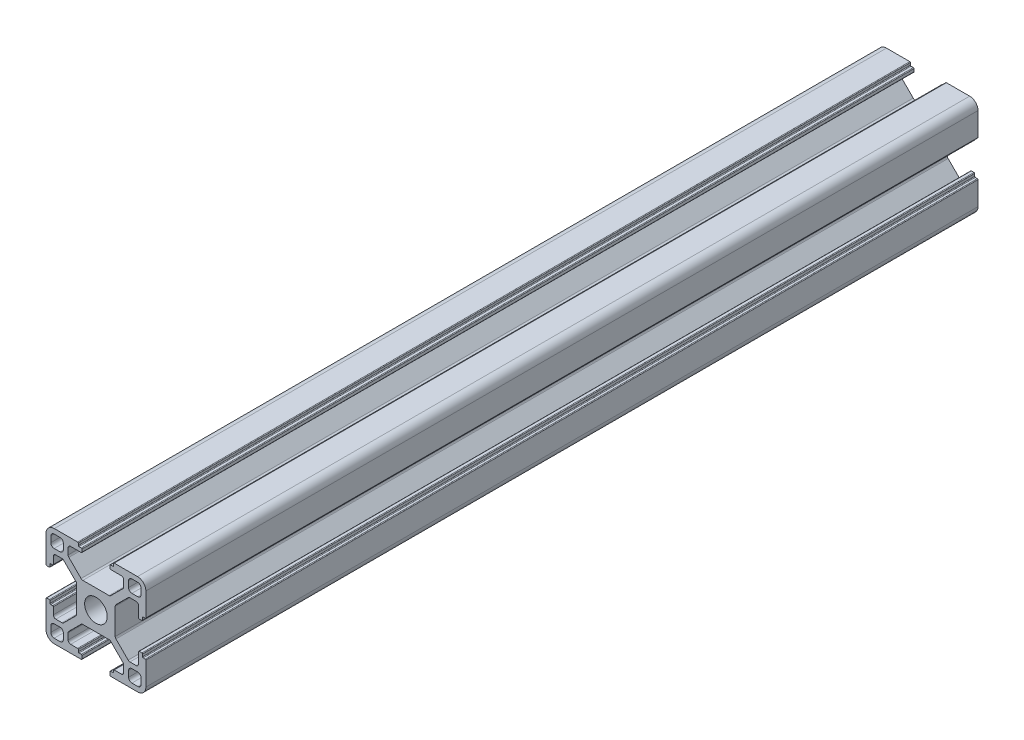
from build123d import *

# Parameters (mm, degrees)
SKETCH1_R           = 3.4
BOSS_EXTRUDE1_DEPTH = 250


with BuildPart() as part:
    # Sketch1 → Boss-Extrude1 (new body)
    with BuildSketch(Plane.XY):
        with BuildLine():
            Line((0, 2.5), (0, 10.6))
            ThreePointArc((0, 10.6), (0.058578644, 10.741421356), (0.2, 10.8))
            Line((0.2, 10.8), (1, 10.8))
            ThreePointArc((1, 10.8), (1.141421356, 10.741421356), (1.2, 10.6))
            Line((1.2, 10.6), (1.2, 9.9))
            ThreePointArc((1.2, 9.9), (1.258578644, 9.758578644), (1.4, 9.7))
            Line((1.4, 9.7), (2, 9.7))
            ThreePointArc((2, 9.7), (2.141421356, 9.641421356), (2.2, 9.5))
            Line((2.2, 9.5), (2.2, 7.4))
            ThreePointArc((2.2, 7.4), (2.419669914, 6.869669914), (2.95, 6.65))
            Line((2.95, 6.65), (4.78370491, 6.65))
            ThreePointArc((4.78370491, 6.65), (5.070717484, 6.707090351), (5.314034995, 6.869669914))
            Line((5.314034995, 6.869669914), (8.980330086, 10.535965005))
            ThreePointArc((8.980330086, 10.535965005), (9.142909649, 10.779282516), (9.2, 11.06629509))
            Line((9.2, 11.06629509), (9.2, 18.93370491))
            ThreePointArc((9.2, 18.93370491), (9.142909649, 19.220717484), (8.980330086, 19.464034995))
            Line((8.980330086, 19.464034995), (5.314034995, 23.130330086))
            ThreePointArc((5.314034995, 23.130330086), (5.070717484, 23.292909649), (4.78370491, 23.35))
            Line((4.78370491, 23.35), (2.95, 23.35))
            ThreePointArc((2.95, 23.35), (2.419669914, 23.130330086), (2.2, 22.6))
            Line((2.2, 22.6), (2.2, 20.5))
            ThreePointArc((2.2, 20.5), (2.141421356, 20.358578644), (2, 20.3))
            Line((2, 20.3), (1.4, 20.3))
            ThreePointArc((1.4, 20.3), (1.258578644, 20.241421356), (1.2, 20.1))
            Line((1.2, 20.1), (1.2, 19.4))
            ThreePointArc((1.2, 19.4), (1.141421356, 19.258578644), (1, 19.2))
            Line((1, 19.2), (0.2, 19.2))
            ThreePointArc((0.2, 19.2), (0.058578644, 19.258578644), (0, 19.4))
            Line((0, 19.4), (0, 27.5))
            ThreePointArc((0, 27.5), (0.732233047, 29.267766953), (2.5, 30))
            Line((2.5, 30), (9.5, 30))
            ThreePointArc((9.5, 30), (9.641421356, 29.941421356), (9.7, 29.8))
            Line((9.7, 29.8), (9.7, 29.2))
            ThreePointArc((9.7, 29.2), (9.758578644, 29.058578644), (9.9, 29))
            Line((9.9, 29), (10.6, 29))
            ThreePointArc((10.6, 29), (10.741421356, 28.941421356), (10.8, 28.8))
            Line((10.8, 28.8), (10.8, 28))
            ThreePointArc((10.8, 28), (10.741421356, 27.858578644), (10.6, 27.8))
            Line((10.6, 27.8), (7.4, 27.8))
            ThreePointArc((7.4, 27.8), (6.869669914, 27.580330086), (6.65, 27.05))
            Line((6.65, 27.05), (6.65, 25.21629509))
            ThreePointArc((6.65, 25.21629509), (6.707090351, 24.929282516), (6.869669914, 24.685965005))
            Line((6.869669914, 24.685965005), (10.535965005, 21.019669914))
            ThreePointArc((10.535965005, 21.019669914), (10.779282516, 20.857090351), (11.06629509, 20.8))
            Line((11.06629509, 20.8), (18.93370491, 20.8))
            ThreePointArc((18.93370491, 20.8), (19.220717484, 20.857090351), (19.464034995, 21.019669914))
            Line((19.464034995, 21.019669914), (23.130330086, 24.685965005))
            ThreePointArc((23.130330086, 24.685965005), (23.292909649, 24.929282516), (23.35, 25.21629509))
            Line((23.35, 25.21629509), (23.35, 27.05))
            ThreePointArc((23.35, 27.05), (23.130330086, 27.580330086), (22.6, 27.8))
            Line((22.6, 27.8), (19.4, 27.8))
            ThreePointArc((19.4, 27.8), (19.258578644, 27.858578644), (19.2, 28))
            Line((19.2, 28), (19.2, 28.8))
            ThreePointArc((19.2, 28.8), (19.258578644, 28.941421356), (19.4, 29))
            Line((19.4, 29), (20.1, 29))
            ThreePointArc((20.1, 29), (20.241421356, 29.058578644), (20.3, 29.2))
            Line((20.3, 29.2), (20.3, 29.8))
            ThreePointArc((20.3, 29.8), (20.358578644, 29.941421356), (20.5, 30))
            Line((20.5, 30), (27.5, 30))
            ThreePointArc((27.5, 30), (29.267766953, 29.267766953), (30, 27.5))
            Line((30, 27.5), (30, 20.5))
            ThreePointArc((30, 20.5), (29.941421356, 20.358578644), (29.8, 20.3))
            Line((29.8, 20.3), (29.2, 20.3))
            ThreePointArc((29.2, 20.3), (29.058578644, 20.241421356), (29, 20.1))
            Line((29, 20.1), (29, 19.4))
            ThreePointArc((29, 19.4), (28.941421356, 19.258578644), (28.8, 19.2))
            Line((28.8, 19.2), (28, 19.2))
            ThreePointArc((28, 19.2), (27.858578644, 19.258578644), (27.8, 19.4))
            Line((27.8, 19.4), (27.8, 22.6))
            ThreePointArc((27.8, 22.6), (27.580330086, 23.130330086), (27.05, 23.35))
            Line((27.05, 23.35), (25.21629509, 23.35))
            ThreePointArc((25.21629509, 23.35), (24.929282516, 23.292909649), (24.685965005, 23.130330086))
            Line((24.685965005, 23.130330086), (21.019669914, 19.464034995))
            ThreePointArc((21.019669914, 19.464034995), (20.857090351, 19.220717484), (20.8, 18.93370491))
            Line((20.8, 18.93370491), (20.8, 11.06629509))
            ThreePointArc((20.8, 11.06629509), (20.857090351, 10.779282516), (21.019669914, 10.535965005))
            Line((21.019669914, 10.535965005), (24.685965005, 6.869669914))
            ThreePointArc((24.685965005, 6.869669914), (24.929282516, 6.707090351), (25.21629509, 6.65))
            Line((25.21629509, 6.65), (27.05, 6.65))
            ThreePointArc((27.05, 6.65), (27.580330086, 6.869669914), (27.8, 7.4))
            Line((27.8, 7.4), (27.8, 10.6))
            ThreePointArc((27.8, 10.6), (27.858578644, 10.741421356), (28, 10.8))
            Line((28, 10.8), (28.8, 10.8))
            ThreePointArc((28.8, 10.8), (28.941421356, 10.741421356), (29, 10.6))
            Line((29, 10.6), (29, 9.9))
            ThreePointArc((29, 9.9), (29.058578644, 9.758578644), (29.2, 9.7))
            Line((29.2, 9.7), (29.8, 9.7))
            ThreePointArc((29.8, 9.7), (29.941421356, 9.641421356), (30, 9.5))
            Line((30, 9.5), (30, 2.5))
            ThreePointArc((30, 2.5), (29.267766953, 0.732233047), (27.5, 0))
            Line((27.5, 0), (19.4, 0))
            ThreePointArc((19.4, 0), (19.258578644, 0.058578644), (19.2, 0.2))
            Line((19.2, 0.2), (19.2, 1.132430858))
            ThreePointArc((19.2, 1.132430858), (19.258578644, 1.273852214), (19.4, 1.332430858))
            Line((19.4, 1.332430858), (20.1, 1.332430858))
            ThreePointArc((20.1, 1.332430858), (20.241421356, 1.391009502), (20.3, 1.532430858))
            Line((20.3, 1.532430858), (20.3, 2))
            ThreePointArc((20.3, 2), (20.358578644, 2.141421356), (20.5, 2.2))
            Line((20.5, 2.2), (22.6, 2.2))
            ThreePointArc((22.6, 2.2), (23.130330086, 2.419669914), (23.35, 2.95))
            Line((23.35, 2.95), (23.35, 4.916135768))
            ThreePointArc((23.35, 4.916135768), (23.292909649, 5.203148342), (23.130330086, 5.446465854))
            Line((23.130330086, 5.446465854), (19.464034995, 9.112760944))
            ThreePointArc((19.464034995, 9.112760944), (19.220717484, 9.275340508), (18.93370491, 9.332430858))
            Line((18.93370491, 9.332430858), (11.06629509, 9.332430858))
            ThreePointArc((11.06629509, 9.332430858), (10.779282516, 9.275340508), (10.535965005, 9.112760944))
            Line((10.535965005, 9.112760944), (6.869669914, 5.446465854))
            ThreePointArc((6.869669914, 5.446465854), (6.707090351, 5.203148342), (6.65, 4.916135768))
            Line((6.65, 4.916135768), (6.65, 3.082430858))
            ThreePointArc((6.65, 3.082430858), (6.869669914, 2.552100772), (7.4, 2.332430858))
            Line((7.4, 2.332430858), (9.5, 2.332430858))
            ThreePointArc((9.5, 2.332430858), (9.641421356, 2.273852214), (9.7, 2.132430858))
            Line((9.7, 2.132430858), (9.7, 1.532430858))
            ThreePointArc((9.7, 1.532430858), (9.758578644, 1.391009502), (9.9, 1.332430858))
            Line((9.9, 1.332430858), (10.6, 1.332430858))
            ThreePointArc((10.6, 1.332430858), (10.741421356, 1.273852214), (10.8, 1.132430858))
            Line((10.8, 1.132430858), (10.8, 0.2))
            ThreePointArc((10.8, 0.2), (10.741421356, 0.058578644), (10.6, 0))
            Line((10.6, 0), (2.5, 0))
            ThreePointArc((2.5, 0), (0.732233047, 0.732233047), (0, 2.5))
        make_face()
        with Locations((15, 15)):
            Circle(SKETCH1_R, mode=Mode.SUBTRACT)
        with BuildLine():
            Line((27.55, 1.45), (25.8, 1.45))
            ThreePointArc((25.8, 1.45), (25.092893219, 1.742893219), (24.8, 2.45))
            Line((24.8, 2.45), (24.8, 4.2))
            ThreePointArc((24.8, 4.2), (25.092893219, 4.907106781), (25.8, 5.2))
            Line((25.8, 5.2), (27.55, 5.2))
            ThreePointArc((27.55, 5.2), (28.257106781, 4.907106781), (28.55, 4.2))
            Line((28.55, 4.2), (28.55, 2.45))
            ThreePointArc((28.55, 2.45), (28.257106781, 1.742893219), (27.55, 1.45))
        make_face(mode=Mode.SUBTRACT)
        with BuildLine():
            Line((24.8, 25.8), (24.8, 27.55))
            ThreePointArc((24.8, 27.55), (25.092893219, 28.257106781), (25.8, 28.55))
            Line((25.8, 28.55), (27.55, 28.55))
            ThreePointArc((27.55, 28.55), (28.257106781, 28.257106781), (28.55, 27.55))
            Line((28.55, 27.55), (28.55, 25.8))
            ThreePointArc((28.55, 25.8), (28.257106781, 25.092893219), (27.55, 24.8))
            Line((27.55, 24.8), (25.8, 24.8))
            ThreePointArc((25.8, 24.8), (25.092893219, 25.092893219), (24.8, 25.8))
        make_face(mode=Mode.SUBTRACT)
        with BuildLine():
            Line((2.45, 28.55), (4.2, 28.55))
            ThreePointArc((4.2, 28.55), (4.907106781, 28.257106781), (5.2, 27.55))
            Line((5.2, 27.55), (5.2, 25.8))
            ThreePointArc((5.2, 25.8), (4.907106781, 25.092893219), (4.2, 24.8))
            Line((4.2, 24.8), (2.45, 24.8))
            ThreePointArc((2.45, 24.8), (1.742893219, 25.092893219), (1.45, 25.8))
            Line((1.45, 25.8), (1.45, 27.55))
            ThreePointArc((1.45, 27.55), (1.742893219, 28.257106781), (2.45, 28.55))
        make_face(mode=Mode.SUBTRACT)
        with BuildLine():
            Line((1.45, 2.45), (1.45, 4.2))
            ThreePointArc((1.45, 4.2), (1.742893219, 4.907106781), (2.45, 5.2))
            Line((2.45, 5.2), (4.2, 5.2))
            ThreePointArc((4.2, 5.2), (4.907106781, 4.907106781), (5.2, 4.2))
            Line((5.2, 4.2), (5.2, 2.45))
            ThreePointArc((5.2, 2.45), (4.907106781, 1.742893219), (4.2, 1.45))
            Line((4.2, 1.45), (2.45, 1.45))
            ThreePointArc((2.45, 1.45), (1.742893219, 1.742893219), (1.45, 2.45))
        make_face(mode=Mode.SUBTRACT)
    extrude(amount=BOSS_EXTRUDE1_DEPTH)


solid = part.part
